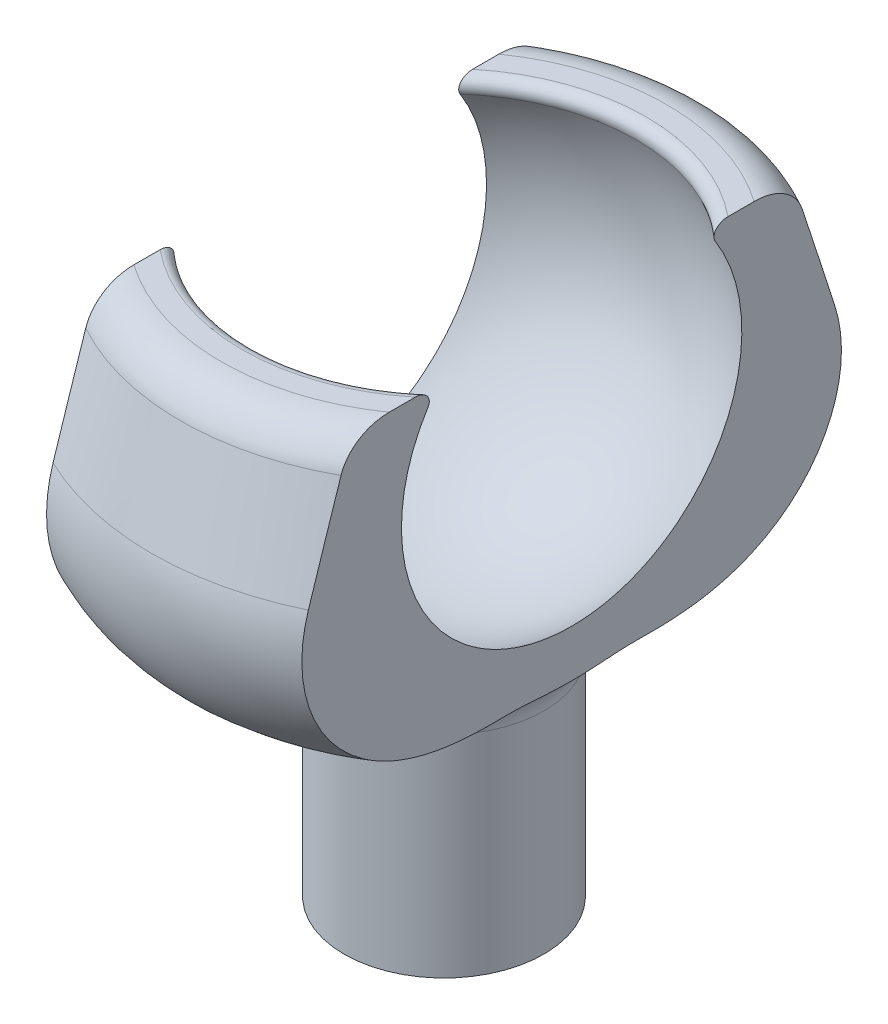
from build123d import *

# Parameters (mm, degrees)
CROQUIS3_W            = 12.155845656
CROQUIS3_H            = 36.65917603
CORTAR_EXTRUIR1_DEPTH = 21


with BuildPart() as part:
    # Croquis2 → Revolución1 (revolve)
    with BuildSketch(Plane(origin=(0, 0, 0), x_dir=(0, 0, -1), z_dir=(1, 0, 0))):
        with BuildLine():
            Line((0, 0), (-4.7, 0))
            Line((-4.7, 0), (-4.7, 9.902147454))
            ThreePointArc((-4.7, 9.902147454), (-5.319949818, 11.349718348), (-6.795461494, 11.899867931))
            Line((-6.795461494, 11.899867931), (-6.695457392, 11.904646648))
            ThreePointArc((-6.695457392, 11.904646648), (-12.523047033, 14.558265513), (-13.753776425, 20.842197345))
            Line((-13.753776425, 20.842197345), (-12.389960221, 25.555865437))
            ThreePointArc((-12.389960221, 25.555865437), (-11.670480634, 26.598707427), (-10.468759134, 27))
            Line((-10.468759134, 27), (-9.486832981, 27))
            ThreePointArc((-9.486832981, 27), (-9.064255853, 26.767261242), (-9.035079029, 26.285714286))
            ThreePointArc((-9.035079029, 26.285714286), (-8.451542547, 16.654775162), (0, 12))
            Line((0, 12), (0, 0))
        make_face()
    revolve(axis=Axis((0, 22, 0), (0, -1, 0)))

    # Croquis3 → Cortar-Extruir1 (cut)
    with BuildSketch(Plane(origin=(0, 30, 0), x_dir=(1, 0, 0), z_dir=(0, 1, 0))):
        with Locations((-12.077922828, -0.329588015)):
            Rectangle(CROQUIS3_W, CROQUIS3_H)
        with Locations((12.077922828, -0.329588015)):
            Rectangle(CROQUIS3_W, CROQUIS3_H)
    extrude(amount=-CORTAR_EXTRUIR1_DEPTH, mode=Mode.SUBTRACT)


solid = part.part
